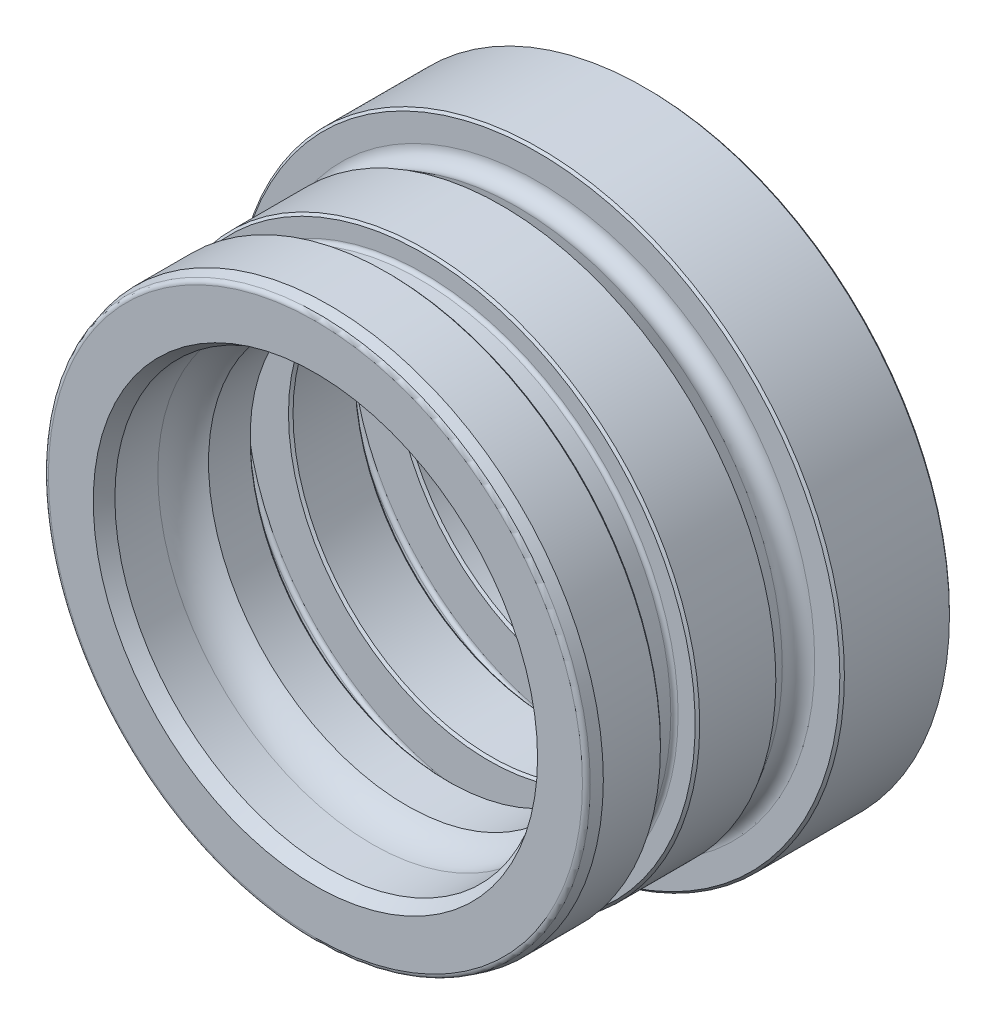
from build123d import *

# Parameters (mm, degrees)
CHAMFER1_SIZE = 0.25


with BuildPart() as part:
    # Sketch1 → Revolve1 (revolve)
    with BuildSketch(Plane(origin=(0, 0, 0), x_dir=(0, 0, -1), z_dir=(1, 0, 0)), mode=Mode.PRIVATE) as revolve1_sk:
        with BuildLine():
            Line((0, 29.229412717), (0, 24.316025404))
            Line((0, 24.316025404), (1.5, 23.45))
            Line((1.5, 23.45), (6.200328962, 23.45))
            ThreePointArc((6.200328962, 23.45), (8.291979028, 22.991475531), (10, 21.7))
            Line((10, 21.7), (14.8, 21.7))
            Line((14.8, 21.7), (14.8, 26.6))
            ThreePointArc((14.8, 26.6), (14.917157288, 26.882842712), (15.2, 27))
            Line((15.2, 27), (18.6, 27))
            ThreePointArc((18.6, 27), (18.882842712, 26.882842712), (19, 26.6))
            Line((19, 26.6), (19, 21.7))
            Line((19, 21.7), (26.3, 21.7))
            Line((26.3, 21.7), (26.3, 26.6))
            ThreePointArc((26.3, 26.6), (26.417157288, 26.882842712), (26.7, 27))
            Line((26.7, 27), (30.1, 27))
            ThreePointArc((30.1, 27), (30.382842712, 26.882842712), (30.5, 26.6))
            Line((30.5, 26.6), (30.5, 21.7))
            Line((30.5, 21.7), (35.8, 21.7))
            Line((35.8, 21.7), (36.3, 22.2))
            Line((36.3, 22.2), (36.3, 33.1))
            Line((36.3, 33.1), (36.05, 33.35))
            Line((36.05, 33.35), (24.3, 33.35))
            Line((24.3, 33.35), (24.3, 30.35))
            ThreePointArc((24.3, 30.35), (23.55, 29.050961894), (22.05, 29.050961894))
            Line((22.05, 29.050961894), (20.380237021, 30.015))
            Line((20.380237021, 30.015), (11.8, 30.015))
            Line((11.8, 30.015), (11.8, 27.9))
            ThreePointArc((11.8, 27.9), (11.682842712, 27.617157288), (11.4, 27.5))
            Line((11.4, 27.5), (8.4, 27.5))
            ThreePointArc((8.4, 27.5), (8.117157288, 27.617157288), (8, 27.9))
            Line((8, 27.9), (8, 30.015))
            Line((8, 30.015), (1.5, 30.015))
            Line((1.5, 30.015), (0.370590477, 29.712375631))
            ThreePointArc((0.370590477, 29.712375631), (0.10332333, 29.533793432), (0, 29.229412717))
        make_face()
    revolve(revolve1_sk.sketch.rotate(Axis((0, 0, 32.950954669), (0, 0, -1)), 90), axis=Axis((0, 0, 32.950954669), (0, 0, -1)))

    # Chamfer1
    chamfer1_edges = [part.edges().sort_by_distance(p)[0] for p in [
        (-33.35, 0, -24.3),
        (-21.7, 0, -30.5),
        (-21.7, 0, -26.3),
        (-21.7, 0, -19),
        (-21.7, 0, -14.8),
        (-30.015, 0, -8),
        (-30.015, 0, -11.8),
    ]]
    chamfer(chamfer1_edges, length=CHAMFER1_SIZE)


solid = part.part
